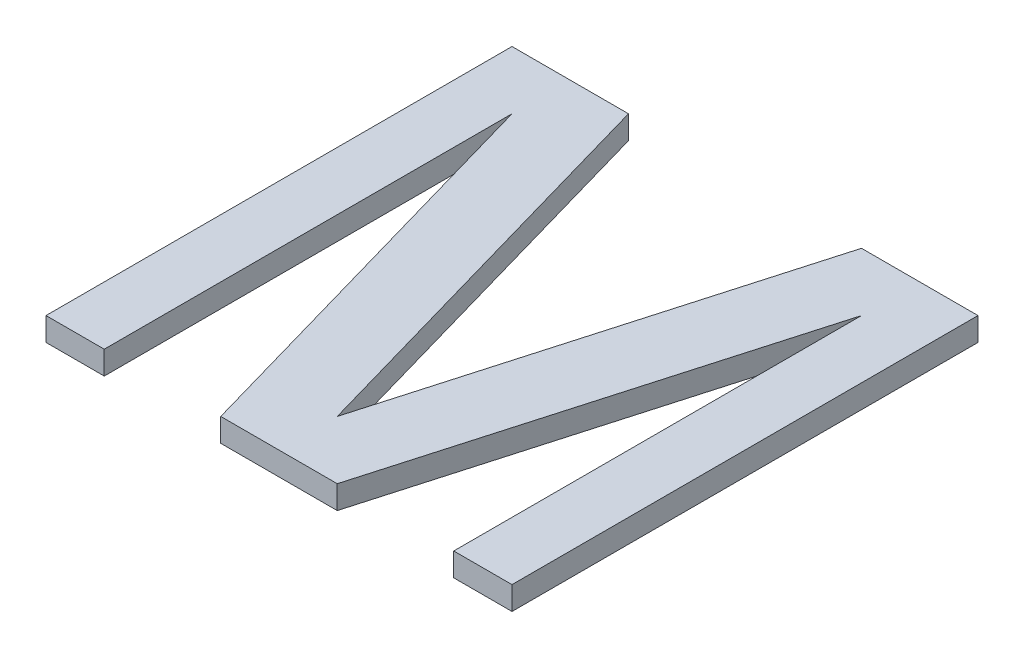
from build123d import *

# Parameters (mm, degrees)
BOSS_EXTRUDE2_DEPTH = 2


with BuildPart() as part:
    # Sketch1 → Boss-Extrude2 (new body)
    with BuildSketch(Plane(origin=(0, 0, 0), x_dir=(1, 0, 0), z_dir=(0, 1, 0))):
        Polygon((-19.14677476, 16.693752194), (-9.14677476, 16.693752194), (0.85322524, -18.306247806), (10.85322524, 16.693752194), (20.85322524, 16.693752194), (20.85322524, -23.306247806), (15.85322524, -23.306247806), (15.85322524, -18.306247806), (15.85322524, 11.693752194), (5.85322524, -23.306247806), (-4.14677476, -23.306247806), (-14.14677476, 11.693752194), (-14.14677476, -18.306247806), (-14.14677476, -23.306247806), (-19.14677476, -23.306247806), align=None)
    extrude(amount=BOSS_EXTRUDE2_DEPTH)


solid = part.part
